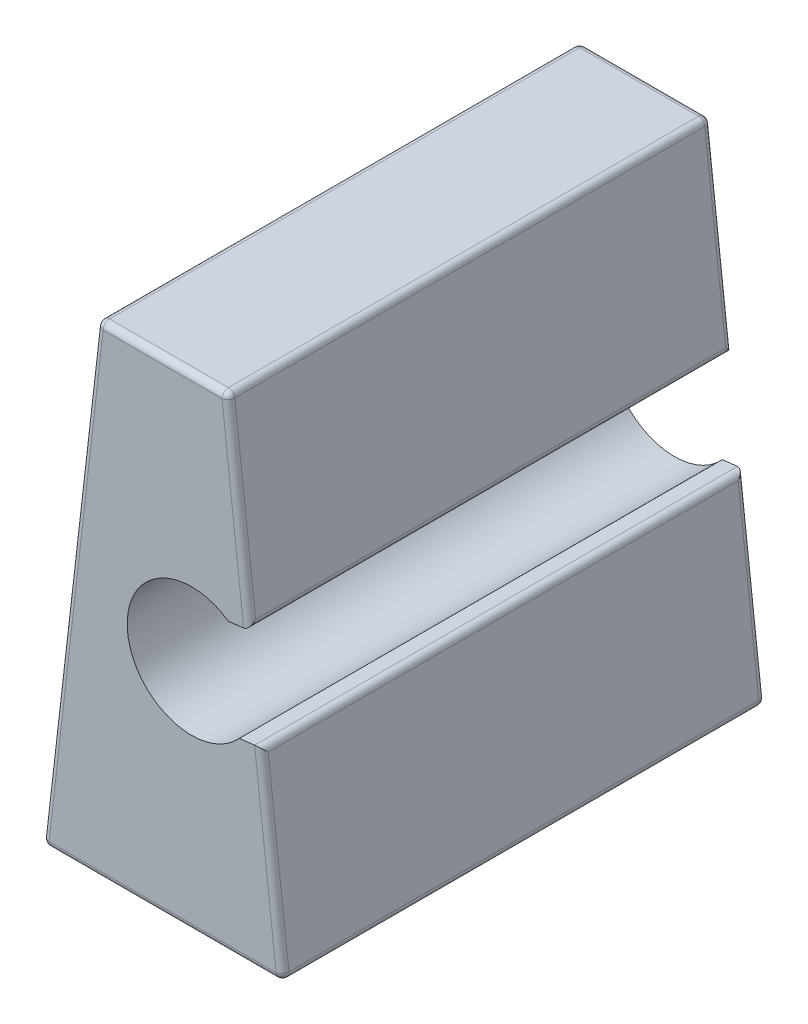
from build123d import *

# Parameters (mm, degrees)
EXTRUDE_1_DEPTH          = 15
CUT_EXTRUDE_1_DEPTH      = 15
SKETCH_3_W               = 3
SKETCH_3_H               = 3
EXTRUDE_2_DEPTH          = 0.68
EXTRUDE_3_DEPTH          = 1
EXTRUDE_3_DEPTH_BACK     = 4
CUT_EXTRUDE_2_DEPTH      = 3
CUT_EXTRUDE_2_DEPTH_BACK = 5
FILLET_3_R               = 0.2
FILLET_4_R               = 0.1


with BuildPart() as part:
    # 草图1 → 凸台-拉伸1 (new body)
    with BuildSketch(Plane.XY):
        Polygon((-3.75, 0), (-2.02443152, 15), (2.02443152, 15), (3.75, 0), align=None)
    extrude(amount=EXTRUDE_1_DEPTH)

    # 草图2 → 切除-拉伸1 (cut)
    with BuildSketch(Plane.XY.offset(15)):
        with BuildLine():
            Line((2.715789487, 8.990172149), (3.058642033, 6.009827851))
            Line((3.058642033, 6.009827851), (2.38595414, 5.93244325))
            ThreePointArc((2.38595414, 5.93244325), (-1.086576637, 7.042863273), (2.043101594, 8.912787547))
            Line((2.043101594, 8.912787547), (2.715789487, 8.990172149))
        make_face()
    extrude(amount=-CUT_EXTRUDE_1_DEPTH, mode=Mode.SUBTRACT)

    # 草图3 → 凸台-拉伸2 (add)
    with BuildSketch(Plane(origin=(-3.701021722, 0.425757762, 0), x_dir=(0, 0, 1), z_dir=(-0.9934480991964022, 0.11428418177094966, 0))):
        with Locations((7.5, 7.120897653)):
            Rectangle(SKETCH_3_W, SKETCH_3_H)
    extrude(amount=EXTRUDE_2_DEPTH)

    # 草图4 → 凸台-拉伸3 (add, two sides: drawn at the far end of the back side and taken through both)
    with BuildSketch(Plane(origin=(0, 0, 6), x_dir=(-1, 0, 0), z_dir=(0, 0, -1)).offset(-EXTRUDE_3_DEPTH_BACK)):
        with BuildLine():
            Line((5.593690162, 5.848486661), (4.65546812, 5.740555569))
            ThreePointArc((4.65546812, 5.740555569), (4.17347222, 5.855308115), (3.734476016, 6.085026481))
            Line((3.734476016, 6.085026481), (3.391044919, 9.070400006))
            ThreePointArc((3.391044919, 9.070400006), (3.76641144, 9.393800948), (4.209759811, 9.615003156))
            Line((4.209759811, 9.615003156), (5.147981853, 9.722934248))
            Line((5.147981853, 9.722934248), (5.593690162, 5.848486661))
        make_face()
    extrude(amount=EXTRUDE_3_DEPTH + EXTRUDE_3_DEPTH_BACK)

    # 草图5 → 切除-拉伸2 (cut, two sides: drawn at the far end of the back side and taken through both)
    with BuildSketch(Plane(origin=(0.642379689, 5.584070089, 0), x_dir=(0.9934480991964022, -0.11428418177094966, 0), z_dir=(-0.11428418177094966, -0.9934480991964022, 0)).offset(-CUT_EXTRUDE_2_DEPTH_BACK)):
        with BuildLine():
            Line((-6.225430372, 9.45), (-6.225430372, 10))
            Line((-6.225430372, 10), (-4.405430372, 10))
            Line((-4.405430372, 10), (-4.405430372, 9.002531198))
            ThreePointArc((-4.405430372, 9.002531198), (-4.815297141, 9.280914794), (-5.281020651, 9.45))
            Line((-5.281020651, 9.45), (-6.225430372, 9.45))
        make_face()
        with BuildLine():
            Line((-6.225430372, 5.55), (-5.281020651, 5.55))
            ThreePointArc((-5.281020651, 5.55), (-4.815297141, 5.719085206), (-4.405430372, 5.997468802))
            Line((-4.405430372, 5.997468802), (-4.405430372, 5))
            Line((-4.405430372, 5), (-6.225430372, 5))
            Line((-6.225430372, 5), (-6.225430372, 5.55))
        make_face()
    extrude(amount=CUT_EXTRUDE_2_DEPTH + CUT_EXTRUDE_2_DEPTH_BACK, mode=Mode.SUBTRACT)

    # 圆角3
    fillet_3_edges = [part.edges().sort_by_distance(p)[0] for p in [
        (0, 0, 15),
        (3.404321016, 3.004913926, 15),
        (2.370110504, 11.995086074, 0),
        (2.370110504, 11.995086074, 15),
        (3.058642033, 6.009827851, 7.5),
        (2.715789487, 8.990172149, 7.5),
        (0, 15, 15),
        (3.404321016, 3.004913926, 0),
        (0, 0, 0),
        (-2.88721576, 7.5, 0),
        (0, 15, 0),
        (-2.88721576, 7.5, 15),
        (2.02443152, 15, 7.5),
        (3.75, 0, 7.5),
        (-3.75, 0, 7.5),
        (-2.02443152, 15, 7.5),
    ]]
    fillet(fillet_3_edges, radius=FILLET_3_R)

    # 圆角4
    fillet_4_edges = [part.edges().sort_by_distance(p)[0] for p in [
        (-5.593690162, 5.848486661, 7.5),
        (-5.147981853, 9.722934248, 7.5),
        (-5.370836008, 7.785710454, 9.45),
        (-5.370836008, 7.785710454, 5.55),
    ]]
    fillet(fillet_4_edges, radius=FILLET_4_R)


solid = part.part
